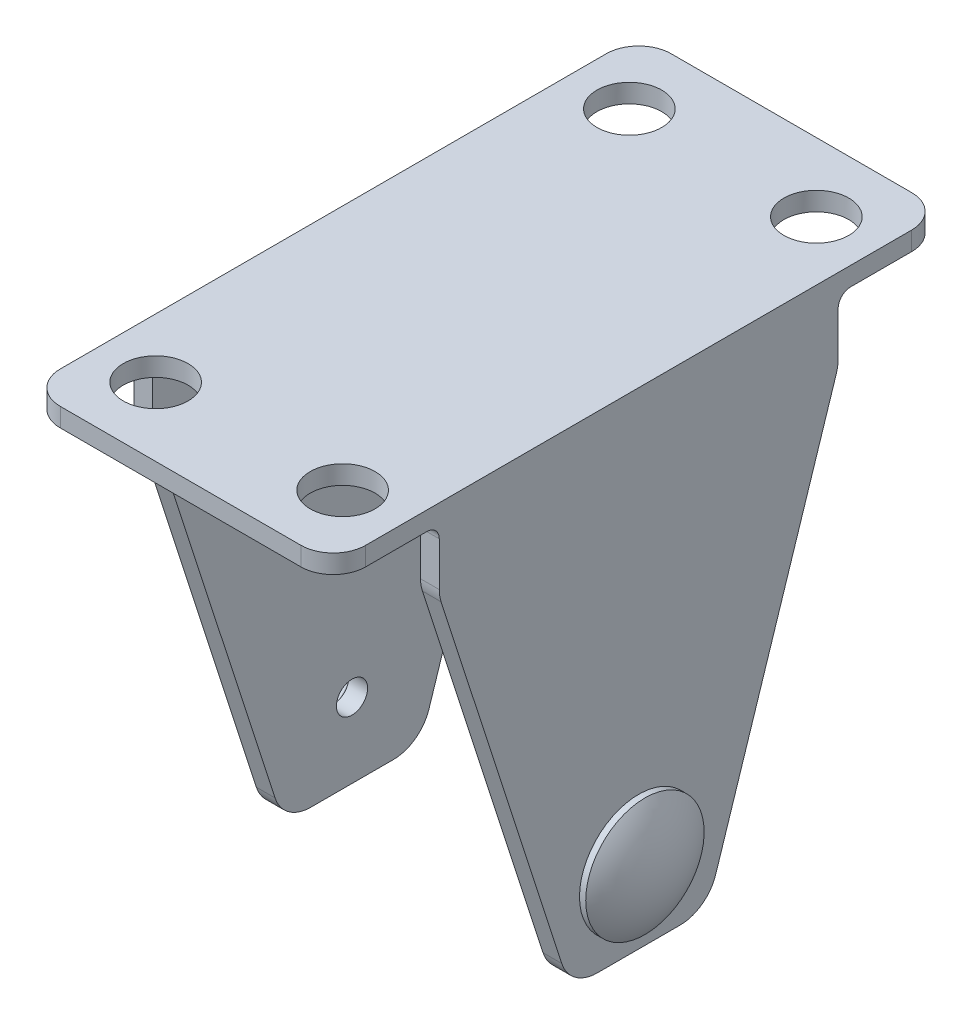
from build123d import *

# Parameters (mm, degrees)
SKETCH_1_W          = 24.5
SKETCH_1_H          = 49
EXTRUDE_1_DEPTH     = 1.5
EXTRUDE_2_DEPTH     = 1.5
EXTRUDE_3_DEPTH     = 1.5
SKETCH_5_R          = 2.6
CUT_EXTRUDE_1_DEPTH = 119.55472929
FILLET_1_R          = 2.6
SKETCH_6_R          = 1.25
CUT_EXTRUDE_2_DEPTH = 100.482631552
FILLET_2_R          = 3
FILLET_3_R          = 1


with BuildPart() as part:
    # 草图1 → 凸台-拉伸1 (new body)
    with BuildSketch(Plane(origin=(0, 0, 0), x_dir=(1, 0, 0), z_dir=(0, 1, 0))):
        with Locations((55.896385498, 64.327326767)):
            Rectangle(SKETCH_1_W, SKETCH_1_H)
    extrude(amount=EXTRUDE_1_DEPTH)

    # 草图2 → 凸台-拉伸2 (add)
    with BuildSketch(Plane(origin=(68.146385498, 0, 0), x_dir=(0, 0, -1), z_dir=(1, 0, 0))):
        Polygon((69.827326767, -37.5), (58.827326767, -37.5), (48.327326767, -5), (48.327326767, 1.5), (64.327326767, 1.5), (80.327326767, 1.5), (80.327326767, -5), align=None)
    extrude(amount=-EXTRUDE_2_DEPTH)

    # 草图4 → 凸台-拉伸3 (add)
    with BuildSketch(Plane.ZY.offset(-43.646385498)):
        Polygon((-48.327326767, -5), (-48.327326767, 0), (-80.327326767, 0), (-80.327326767, -5), (-69.827326767, -37.5), (-58.827326767, -37.5), align=None)
    extrude(amount=-EXTRUDE_3_DEPTH)

    # 草图5 → 切除-拉伸1 (cut, through all)
    with BuildSketch(Plane(origin=(0, 1.5, 0), x_dir=(1, 0, 0), z_dir=(0, 1, 0))):
        with Locations(Location((48.396385498, 83.327326767, 0), (0, 0, 270))):
            Circle(SKETCH_5_R)
        with Locations(Location((63.396385498, 83.327326767, 0), (0, 0, 270))):
            Circle(SKETCH_5_R)
        with Locations(Location((63.396385498, 45.327326767, 0), (0, 0, 90))):
            Circle(SKETCH_5_R)
        with Locations(Location((48.396385498, 45.327326767, 0), (0, 0, 90))):
            Circle(SKETCH_5_R)
    extrude(amount=-CUT_EXTRUDE_1_DEPTH, mode=Mode.SUBTRACT)

    # 圆角1
    fillet_1_edges = [part.edges().sort_by_distance(p)[0] for p in [
        (43.646385498, 0.75, -39.827326767),
        (43.646385498, 0.75, -88.827326767),
        (68.146385498, 0.75, -88.827326767),
        (68.146385498, 0.75, -39.827326767),
    ]]
    fillet(fillet_1_edges, radius=FILLET_1_R)

    # 草图6 → 切除-拉伸2 (cut, through all)
    with BuildSketch(Plane.ZY.offset(-43.646385498)):
        with Locations((-64.327326767, -31.5)):
            Circle(SKETCH_6_R)
    extrude(amount=-CUT_EXTRUDE_2_DEPTH, mode=Mode.SUBTRACT)

    # 圆角2
    fillet_2_edges = [part.edges().sort_by_distance(p)[0] for p in [
        (67.396385498, -5, -80.327326767),
        (67.396385498, -37.5, -69.827326767),
        (67.396385498, -37.5, -58.827326767),
        (67.396385498, -5, -48.327326767),
        (44.396385498, -5, -48.327326767),
        (44.396385498, -37.5, -58.827326767),
        (44.396385498, -37.5, -69.827326767),
        (44.396385498, -5, -80.327326767),
    ]]
    fillet(fillet_2_edges, radius=FILLET_2_R)

    # 圆角3
    fillet_3_edges = [part.edges().sort_by_distance(p)[0] for p in [
        (67.396385498, 0, -48.327326767),
        (67.396385498, 0, -80.327326767),
        (44.396385498, 0, -80.327326767),
        (44.396385498, 0, -48.327326767),
    ]]
    fillet(fillet_3_edges, radius=FILLET_3_R)

    # 草图9 → 旋转1 (revolve)
    with BuildSketch(Plane(origin=(0, 0, -64.327326767), x_dir=(-1, 0, 0), z_dir=(0, 0, 1))):
        with BuildLine():
            Line((-68.146385498, 31.5), (-68.146385498, 26.75))
            Line((-68.146385498, 26.75), (-68.646385498, 26.75))
            ThreePointArc((-68.646385498, 26.75), (-69.762475458, 29.009392644), (-70.146385498, 31.5))
            Line((-70.146385498, 31.5), (-68.146385498, 31.5))
        make_face()
    revolve(axis=Axis((68.146385498, -31.5, -64.327326767), (1, 0, 0)))

    # 草图10 → 旋转2 (revolve)
    with BuildSketch(Plane(origin=(0, 0, -64.327326767), x_dir=(-1, 0, 0), z_dir=(0, 0, 1)), mode=Mode.PRIVATE) as revolve_2_sk:
        with BuildLine():
            Line((-42.146385498, 28.5), (-42.146385498, 28.25))
            ThreePointArc((-42.146385498, 28.25), (-42.896385498, 27.5), (-43.646385498, 28.25))
            Line((-43.646385498, 28.25), (-43.646385498, 29.25))
            Line((-43.646385498, 29.25), (-42.896385498, 29.25))
            ThreePointArc((-42.896385498, 29.25), (-42.366055412, 29.030330086), (-42.146385498, 28.5))
        make_face()
    revolve(revolve_2_sk.sketch.rotate(Axis((68.146385498, -31.5, -64.327326767), (-1, 0, 0)), 90), axis=Axis((68.146385498, -31.5, -64.327326767), (-1, 0, 0)))


solid = part.part
